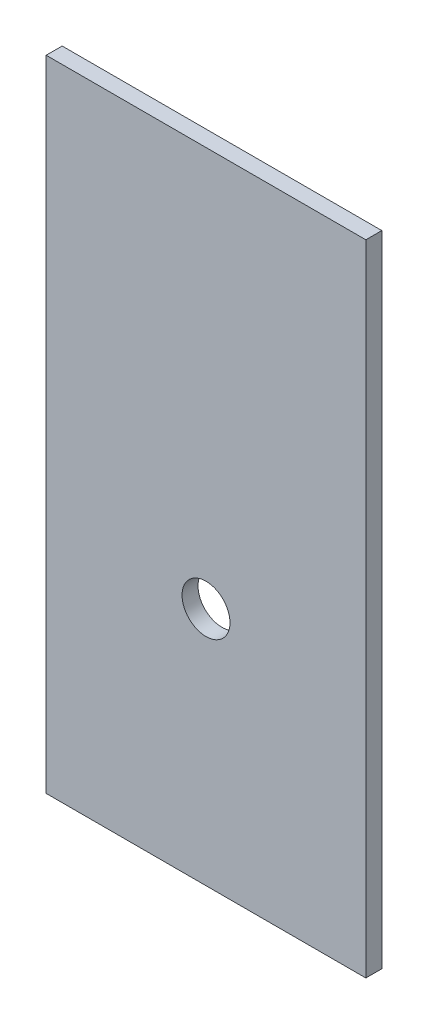
from build123d import *

# Parameters (mm, degrees)
CROQUIS1_W              = 200
CROQUIS1_H              = 400
CROQUIS1_R              = 15
SALIENTE_EXTRUIR1_DEPTH = 10


with BuildPart() as part:
    # Croquis1 → Saliente-Extruir1 (new body)
    with BuildSketch(Plane.XY):
        Rectangle(CROQUIS1_W, CROQUIS1_H)
        with Locations((0, -50)):
            Circle(CROQUIS1_R, mode=Mode.SUBTRACT)
    extrude(amount=SALIENTE_EXTRUIR1_DEPTH)


solid = part.part
